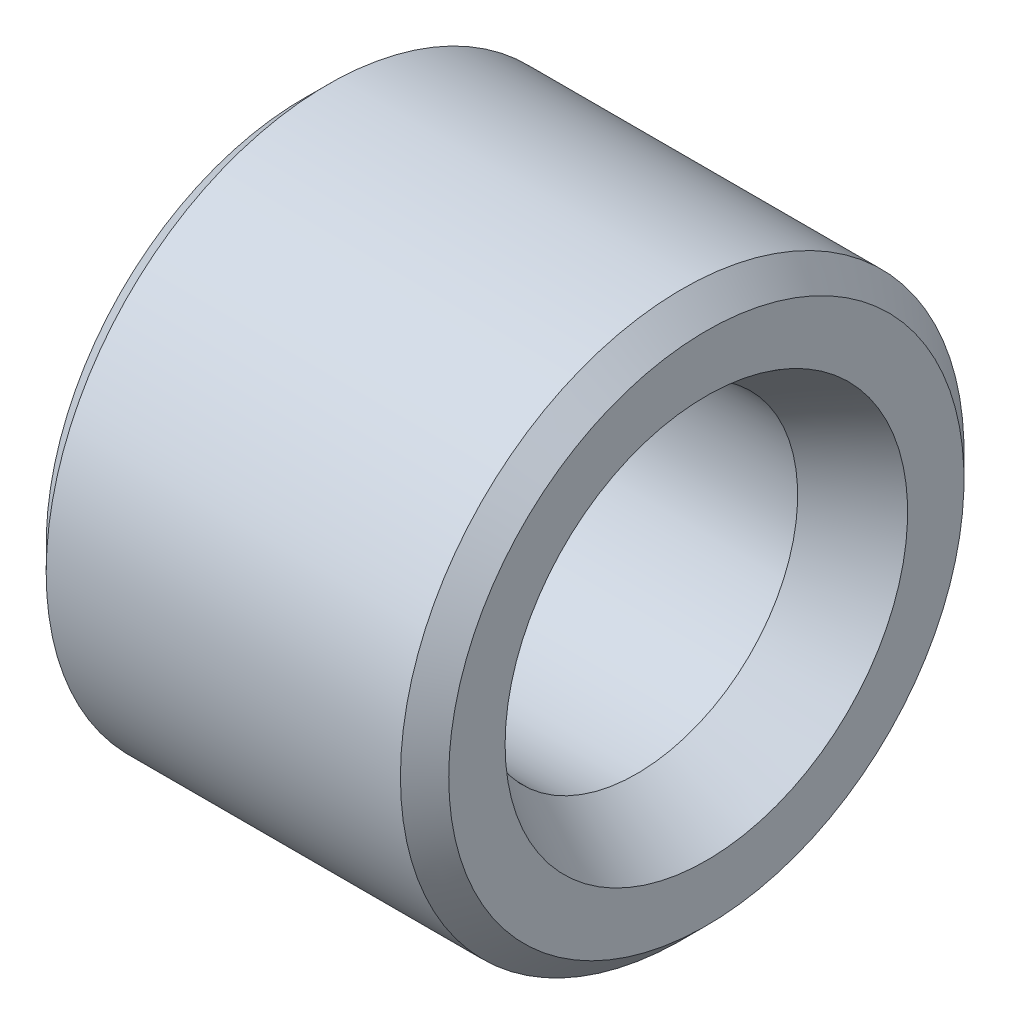
from build123d import *

# Parameters (mm, degrees)
SKETCH1_W     = 5
SKETCH1_H     = 1.5
CHAMFER1_SIZE = 0.3


with BuildPart() as part:
    # Sketch1 → Revolve1 (revolve)
    with BuildSketch(Plane.XY, mode=Mode.PRIVATE) as revolve1_sk:
        with Locations((2.5, 2.75)):
            Rectangle(SKETCH1_W, SKETCH1_H)
    revolve(revolve1_sk.sketch.rotate(Axis((0, 0, 0), (1, 0, 0)), 90), axis=Axis((0, 0, 0), (1, 0, 0)))

    # Chamfer1
    chamfer1_edges = [part.edges().sort_by_distance(p)[0] for p in [
        (5, 0, -3.5),
        (0, 0, -3.5),
    ]]
    chamfer(chamfer1_edges, length=CHAMFER1_SIZE)

    # Sketch2 → Cut-Revolve1 (revolve, cut)
    with BuildSketch(Plane.XY, mode=Mode.PRIVATE) as cut_revolve1_sk:
        Polygon((0, 2.5), (0, 2), (0.866025404, 2), align=None)
        Polygon((4.133974596, 2), (5, 2.5), (5, 2), align=None)
    revolve(cut_revolve1_sk.sketch.rotate(Axis((0, 0, 0), (1, 0, 0)), 90), axis=Axis((0, 0, 0), (1, 0, 0)), mode=Mode.SUBTRACT)


solid = part.part
